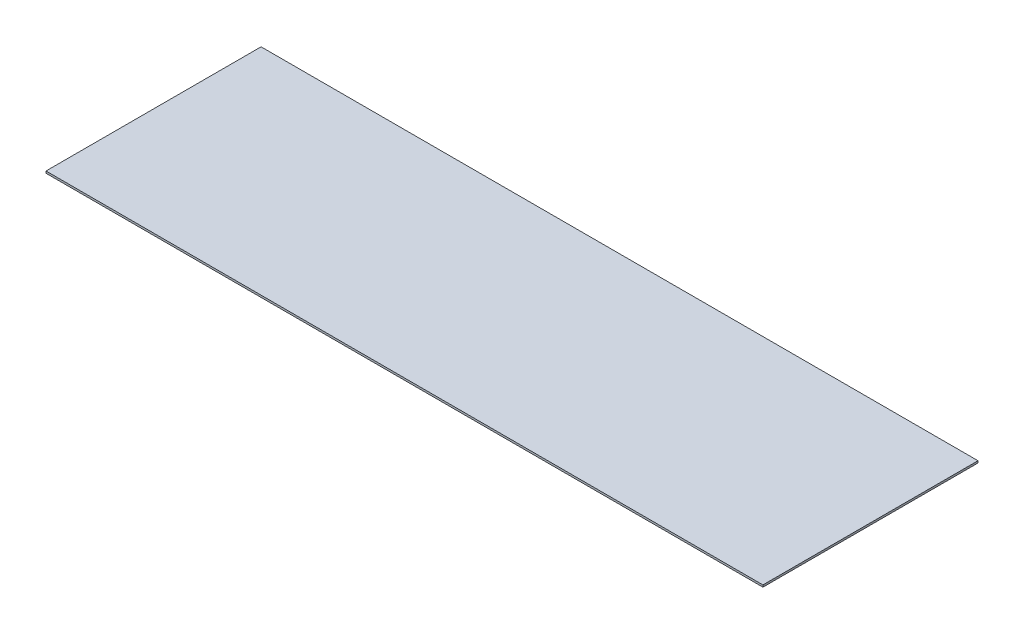
from build123d import *

# Parameters (mm, degrees)
SKETCH1_W           = 1800
SKETCH1_H           = 540
BOSS_EXTRUDE1_DEPTH = 5


with BuildPart() as part:
    # Sketch1 → Boss-Extrude1 (new body)
    with BuildSketch(Plane(origin=(0, 0, 0), x_dir=(1, 0, 0), z_dir=(0, 1, 0))):
        Rectangle(SKETCH1_W, SKETCH1_H)
    extrude(amount=BOSS_EXTRUDE1_DEPTH)


solid = part.part
